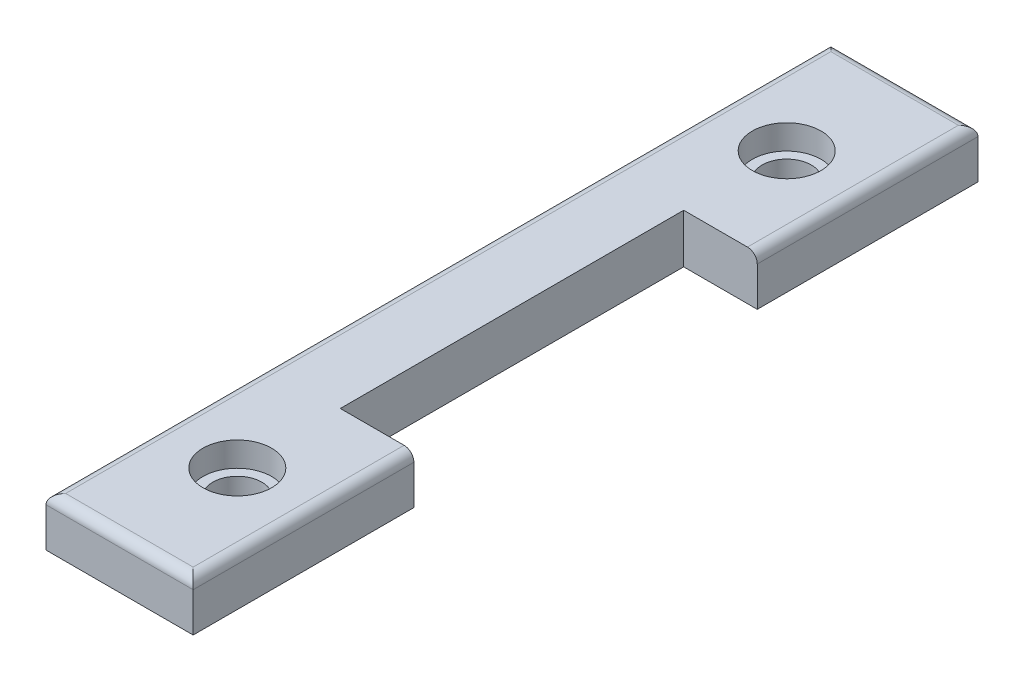
from build123d import *

# Parameters (mm, degrees)
SKETCH1_W           = 15
SKETCH1_H           = 80
BOSS_EXTRUDE1_DEPTH = 5
SKETCH2_R           = 3.5
CUT_EXTRUDE1_DEPTH  = 2.5
FILLET1_R           = 1
SKETCH3_W           = 7.5
SKETCH3_H           = 35
CUT_EXTRUDE2_DEPTH  = 42.003048667
SKETCH4_R           = 2.5
CUT_EXTRUDE3_DEPTH  = 41.773766076


with BuildPart() as part:
    # Sketch1 → Boss-Extrude1 (new body)
    with BuildSketch(Plane(origin=(0, 0, 0), x_dir=(1, 0, 0), z_dir=(0, 1, 0))):
        Rectangle(SKETCH1_W, SKETCH1_H)
    extrude(amount=BOSS_EXTRUDE1_DEPTH)

    # Sketch2 → Cut-Extrude1 (cut)
    with BuildSketch(Plane(origin=(0, 5, 0), x_dir=(1, 0, 0), z_dir=(0, 1, 0))):
        with Locations(Location((0, -28, 0), (0, 0, 270))):
            Circle(SKETCH2_R)
    cut_extrude1 = extrude(amount=-CUT_EXTRUDE1_DEPTH, mode=Mode.SUBTRACT)

    # Mirror1: Cut-Extrude1 across plane
    add(cut_extrude1.mirror(Plane.XY), mode=Mode.SUBTRACT)

    # Fillet1
    fillet1_edges = [part.edges().sort_by_distance(p)[0] for p in [
        (-7.5, 5, 0),
        (0, 5, 40),
        (7.5, 5, 0),
        (0, 5, -40),
    ]]
    fillet(fillet1_edges, radius=FILLET1_R)

    # Sketch3 → Cut-Extrude2 (cut, through all)
    with BuildSketch(Plane(origin=(0, 5, 0), x_dir=(1, 0, 0), z_dir=(0, 1, 0))):
        with Locations((3.75, 0)):
            Rectangle(SKETCH3_W, SKETCH3_H)
    extrude(amount=-CUT_EXTRUDE2_DEPTH, mode=Mode.SUBTRACT)

    # Sketch4 → Cut-Extrude3 (cut, through all)
    with BuildSketch(Plane(origin=(0, 2.5, 0), x_dir=(1, 0, 0), z_dir=(0, 1, 0))):
        with Locations(Location((0, 28, 0), (0, 0, 270))):
            Circle(SKETCH4_R)
        with Locations(Location((0, -28, 0), (0, 0, 270))):
            Circle(SKETCH4_R)
    extrude(amount=-CUT_EXTRUDE3_DEPTH, mode=Mode.SUBTRACT)


solid = part.part
